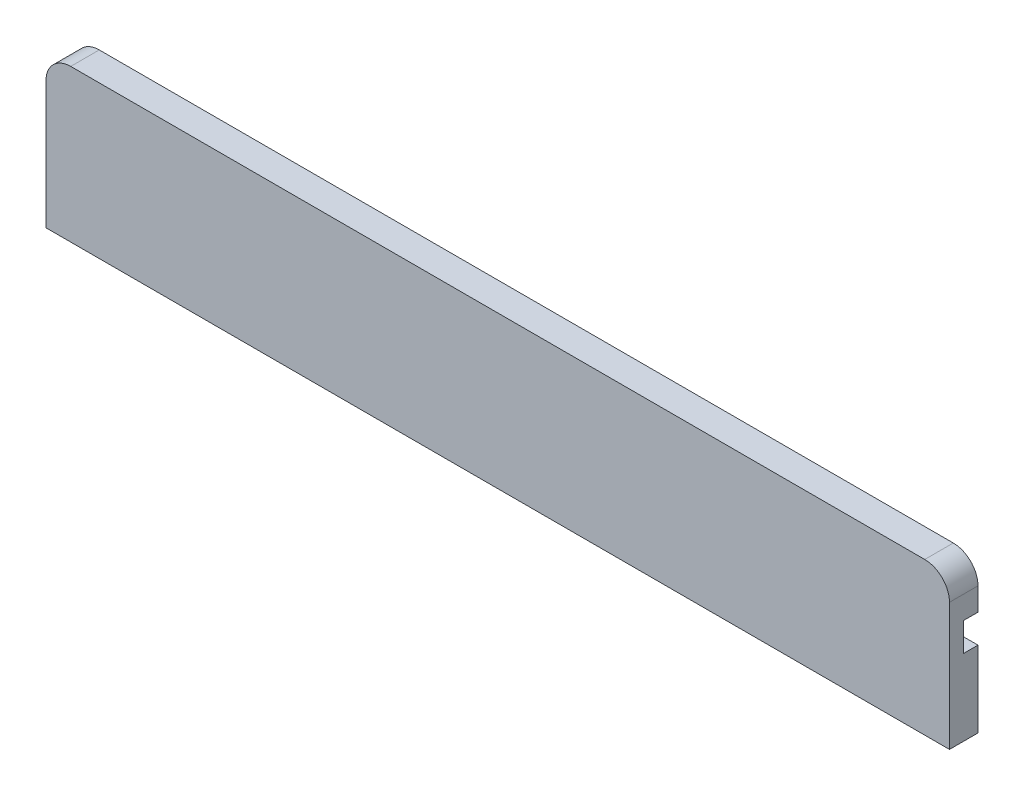
from build123d import *

# Parameters (mm, degrees)
SKETCH1_W           = 603.25
SKETCH1_H           = 101.6
BOSS_EXTRUDE1_DEPTH = 19.05
SKETCH2_W           = 9.525
SKETCH2_H           = 19.05
CUT_EXTRUDE1_DEPTH  = 613.042502609
FILLET1_R           = 16.51


with BuildPart() as part:
    # Sketch1 → Boss-Extrude1 (new body)
    with BuildSketch(Plane.XY):
        with Locations((0, 50.8)):
            Rectangle(SKETCH1_W, SKETCH1_H)
    extrude(amount=BOSS_EXTRUDE1_DEPTH)

    # Sketch2 → Cut-Extrude1 (cut, through all)
    with BuildSketch(Plane(origin=(301.625, 0, 0), x_dir=(0, 0, -1), z_dir=(1, 0, 0))):
        with Locations((-4.7625, 60.325)):
            Rectangle(SKETCH2_W, SKETCH2_H)
    extrude(amount=-CUT_EXTRUDE1_DEPTH, mode=Mode.SUBTRACT)

    # Fillet1
    fillet1_edges = [part.edges().sort_by_distance(p)[0] for p in [
        (301.625, 101.6, 9.525),
        (-301.625, 101.6, 9.525),
    ]]
    fillet(fillet1_edges, radius=FILLET1_R)


solid = part.part
